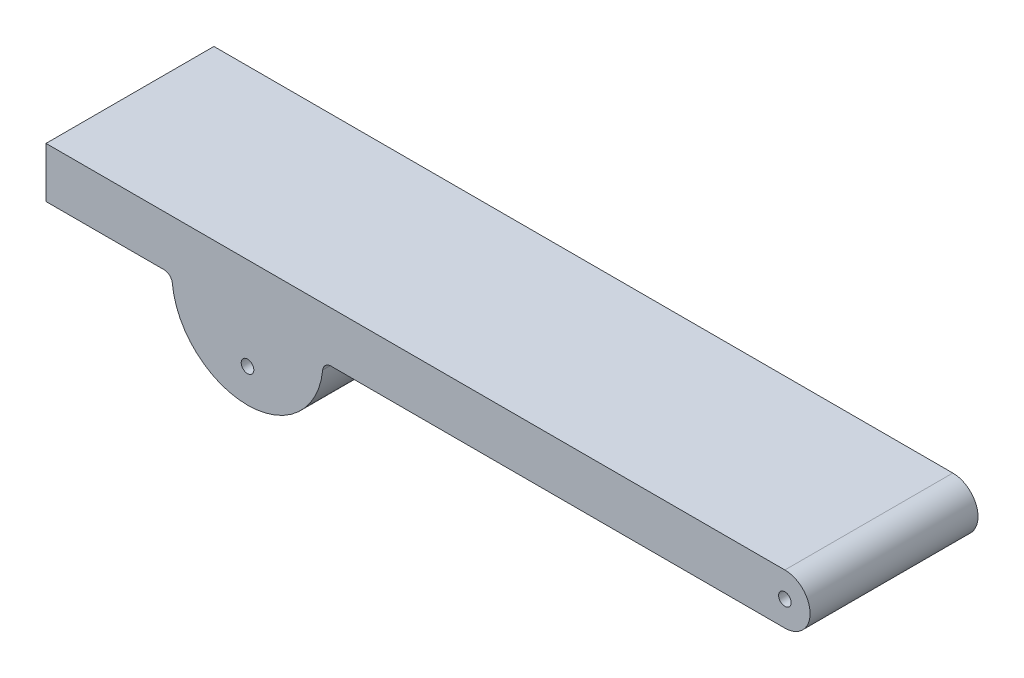
from build123d import *

# Parameters (mm, degrees)
BOSS_EXTRUDE1_DEPTH   = 100
SKETCH2_R             = 7.5
CUT_EXTRUDE1_DEPTH    = 525.690384894
FILLET1_R             = 10
BODY_MOVE_COPY1_ANGLE = 180


with BuildPart() as part:
    # Sketch1 → Boss-Extrude1 (new, symmetric)
    with BuildSketch(Plane.XY):
        with BuildLine():
            Line((440, -30), (-440, -30))
            ThreePointArc((-440, -30), (-470, 0), (-440, 30))
            Line((-440, 30), (110, 30))
            ThreePointArc((110, 30), (200, 120), (290, 30))
            Line((290, 30), (440, 30))
            Line((440, 30), (440, -30))
        make_face()
    extrude(amount=BOSS_EXTRUDE1_DEPTH, both=True)

    # Sketch2 → Cut-Extrude1 (cut, through all)
    with BuildSketch(Plane.XY.offset(100)):
        with Locations((-440, 0)):
            Circle(SKETCH2_R)
        with Locations((200, 80)):
            Circle(SKETCH2_R)
    extrude(amount=-CUT_EXTRUDE1_DEPTH, mode=Mode.SUBTRACT)

    # Fillet1
    fillet1_edges = [part.edges().sort_by_distance(p)[0] for p in [
        (110, 30, 0),
        (290, 30, 0),
    ]]
    fillet(fillet1_edges, radius=FILLET1_R)


with BuildPart() as part_1:
    # Body-Move/Copy1: moved
    add(part.part.rotate(Axis((0, 0, 0), (0, 0, 1)), BODY_MOVE_COPY1_ANGLE))


solid = part_1.part
